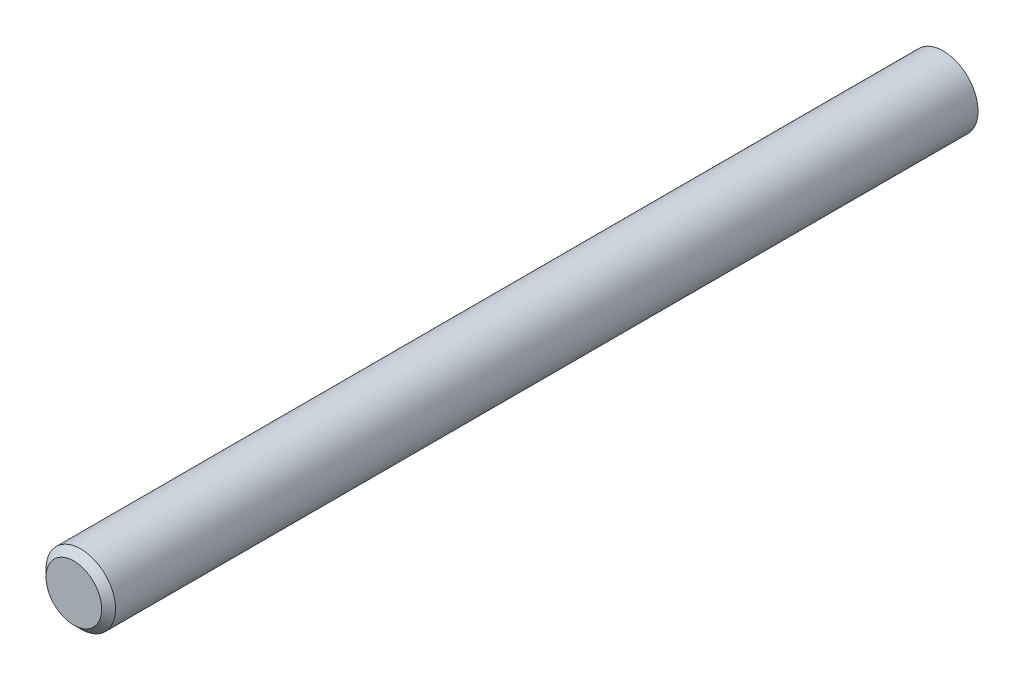
from build123d import *

# Parameters (mm, degrees)
SKETCH1_R          = 4
EXTRUDE1_DEPTH     = 300
CHAMFER1_SIZE      = 0.8
SKETCH3_R          = 12.756821692
CUT_EXTRUDE1_DEPTH = 500


with BuildPart() as part:
    # Sketch1 → Extrude1 (new, symmetric)
    with BuildSketch(Plane.XY):
        Circle(SKETCH1_R)
    extrude(amount=EXTRUDE1_DEPTH, both=True)

    # Chamfer1
    chamfer1_edges = [part.edges().sort_by_distance(p)[0] for p in [
        (-4, 0, -300),
        (-4, 0, 300),
    ]]
    chamfer(chamfer1_edges, length=CHAMFER1_SIZE)

    # Sketch3 → Cut-Extrude1 (cut)
    with BuildSketch(Plane(origin=(0, 0, -300), x_dir=(-1, 0, 0), z_dir=(0, 0, -1))):
        Circle(SKETCH3_R)
    extrude(amount=-CUT_EXTRUDE1_DEPTH, mode=Mode.SUBTRACT)


solid = part.part
